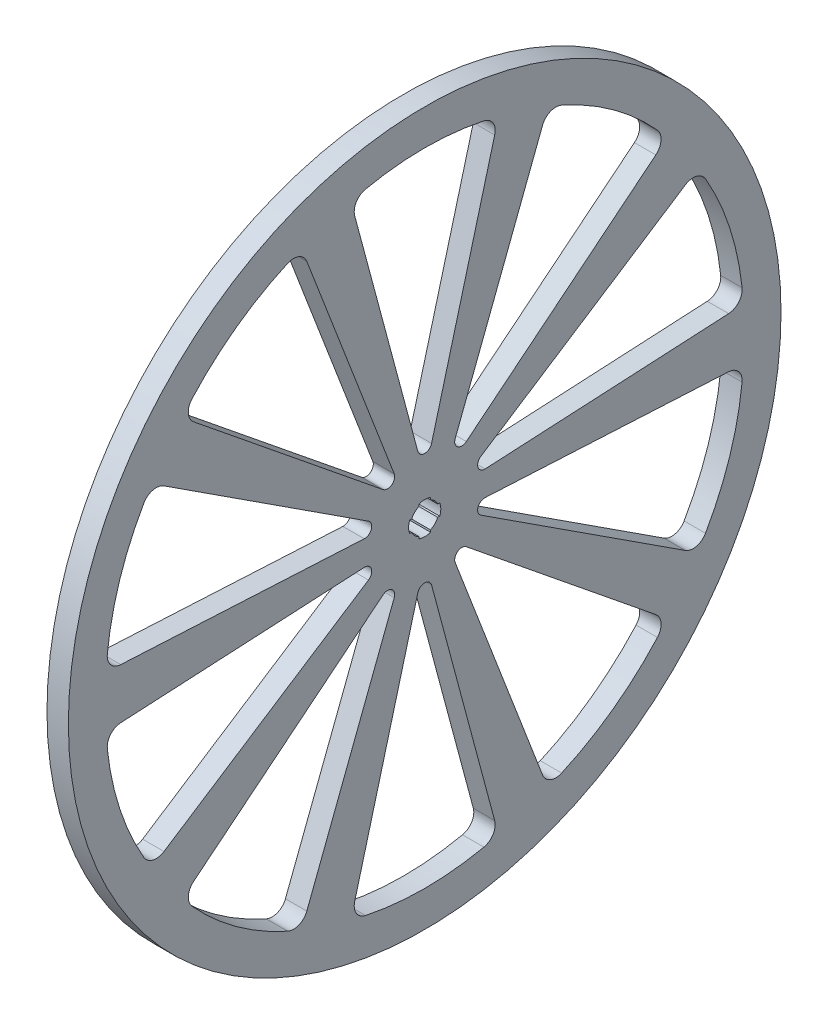
from build123d import *

# Parameters (mm, degrees)
SKETCH1_R           = 50
BOSS_EXTRUDE1_DEPTH = 3
SKETCH2_R           = 2
CUT_EXTRUDE1_DEPTH  = 3
CUT_EXTRUDE2_DEPTH  = 3
CIRPATTERN2_COUNT   = 10
CUT_EXTRUDE3_DEPTH  = 10


with BuildPart() as part:
    # Sketch1 → Boss-Extrude1 (new body)
    with BuildSketch(Plane(origin=(0, 0, 0), x_dir=(0, 0, -1), z_dir=(1, 0, 0))):
        Circle(SKETCH1_R)
    extrude(amount=BOSS_EXTRUDE1_DEPTH)

    # Sketch2 → Cut-Extrude1 (cut)
    with BuildSketch(Plane(origin=(3, 0, 0), x_dir=(0, 0, -1), z_dir=(1, 0, 0))):
        Circle(SKETCH2_R)
    extrude(amount=-CUT_EXTRUDE1_DEPTH, mode=Mode.SUBTRACT)

    # Sketch3 → Cut-Extrude2 (cut)
    with BuildSketch(Plane(origin=(3, 0, 0), x_dir=(0, 0, -1), z_dir=(1, 0, 0))):
        with BuildLine():
            Line((0.965925826, 8.60488426), (9.821492212, 41.654307942))
            ThreePointArc((9.821492212, 41.654307942), (9.594766194, 43.217195558), (8.3048848, 44.128364245))
            ThreePointArc((8.3048848, 44.128364245), (0, 45), (-8.3048848, 44.128364245))
            ThreePointArc((-8.3048848, 44.128364245), (-9.594766194, 43.217195558), (-9.821492212, 41.654307942))
            Line((-9.821492212, 41.654307942), (-0.965925826, 8.60488426))
            ThreePointArc((-0.965925826, 8.60488426), (0, 7.863703305), (0.965925826, 8.60488426))
        make_face()
    cut_extrude2 = extrude(amount=-CUT_EXTRUDE2_DEPTH, mode=Mode.SUBTRACT)

    # CirPattern2: Cut-Extrude2 ×10 about axis
    cirpattern2_axis = Axis((0, 0, 0), (1, 0, 0))
    for i in range(1, CIRPATTERN2_COUNT):
        add(cut_extrude2.rotate(cirpattern2_axis, i * 360 / CIRPATTERN2_COUNT), mode=Mode.SUBTRACT)

    # Sketch4 → Cut-Extrude3 (cut)
    with BuildSketch(Plane(origin=(3, 0, 0), x_dir=(0, 0, -1), z_dir=(1, 0, 0))):
        with BuildLine():
            Line((-2.109857815, 0.81), (-0.81, 0.81))
            Line((-0.81, 0.81), (-0.81, 2.109857815))
            add(Edge.make_bspline(
                [(-0.81, 2.109857815), (0, 2.410142185), (0.81, 2.109857815)],
                knots=[0, 0, 0, 1, 1, 1], degree=2))
            Line((0.81, 2.109857815), (0.81, 0.81))
            Line((0.81, 0.81), (2.109857815, 0.81))
            add(Edge.make_bspline(
                [(2.109857815, 0.81), (2.410142185, 0), (2.109857815, -0.81)],
                knots=[0, 0, 0, 1, 1, 1], degree=2))
            Line((2.109857815, -0.81), (0.81, -0.81))
            Line((0.81, -0.81), (0.81, -2.109857815))
            add(Edge.make_bspline(
                [(0.81, -2.109857815), (0, -2.410142185), (-0.81, -2.109857815)],
                knots=[0, 0, 0, 1, 1, 1], degree=2))
            Line((-0.81, -2.109857815), (-0.81, -0.81))
            Line((-0.81, -0.81), (-2.109857815, -0.81))
            add(Edge.make_bspline(
                [(-2.109857815, -0.81), (-2.410142185, 0), (-2.109857815, 0.81)],
                knots=[0, 0, 0, 1, 1, 1], degree=2))
        make_face()
    extrude(amount=-CUT_EXTRUDE3_DEPTH, mode=Mode.SUBTRACT)


solid = part.part
